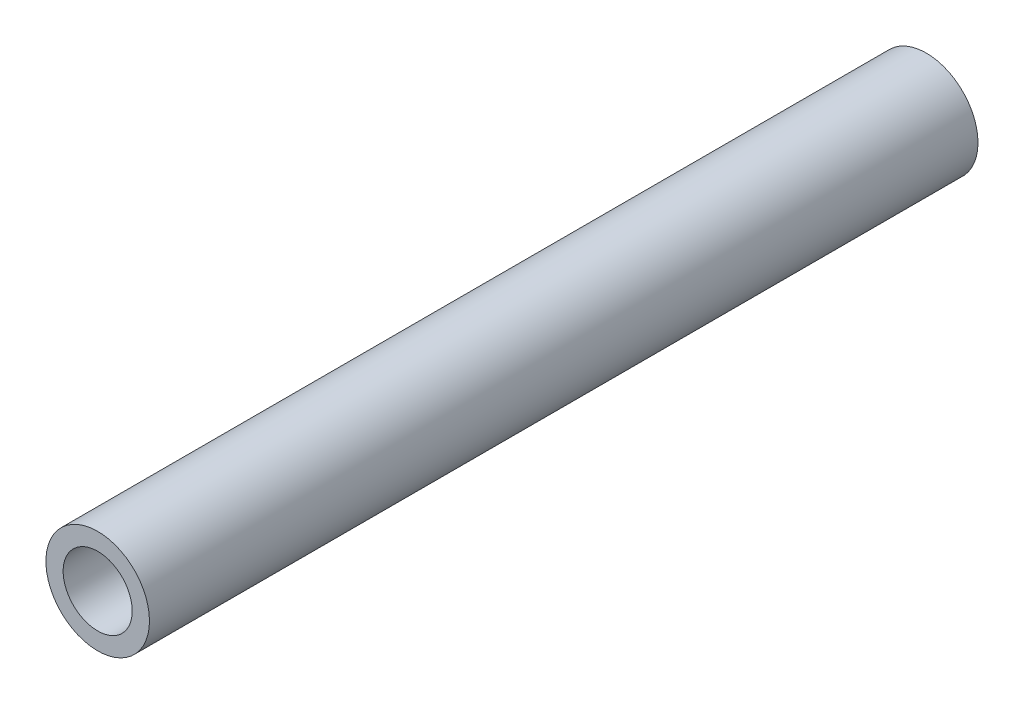
from build123d import *

# Parameters (mm, degrees)
SKETCH_1_R      = 7.5
SKETCH_1_R_2    = 5
EXTRUDE_1_DEPTH = 120


with BuildPart() as part:
    # 草图1 → 凸台-拉伸1 (new body)
    with BuildSketch(Plane.XY):
        Circle(SKETCH_1_R)
        Circle(SKETCH_1_R_2, mode=Mode.SUBTRACT)
    extrude(amount=EXTRUDE_1_DEPTH)


solid = part.part
